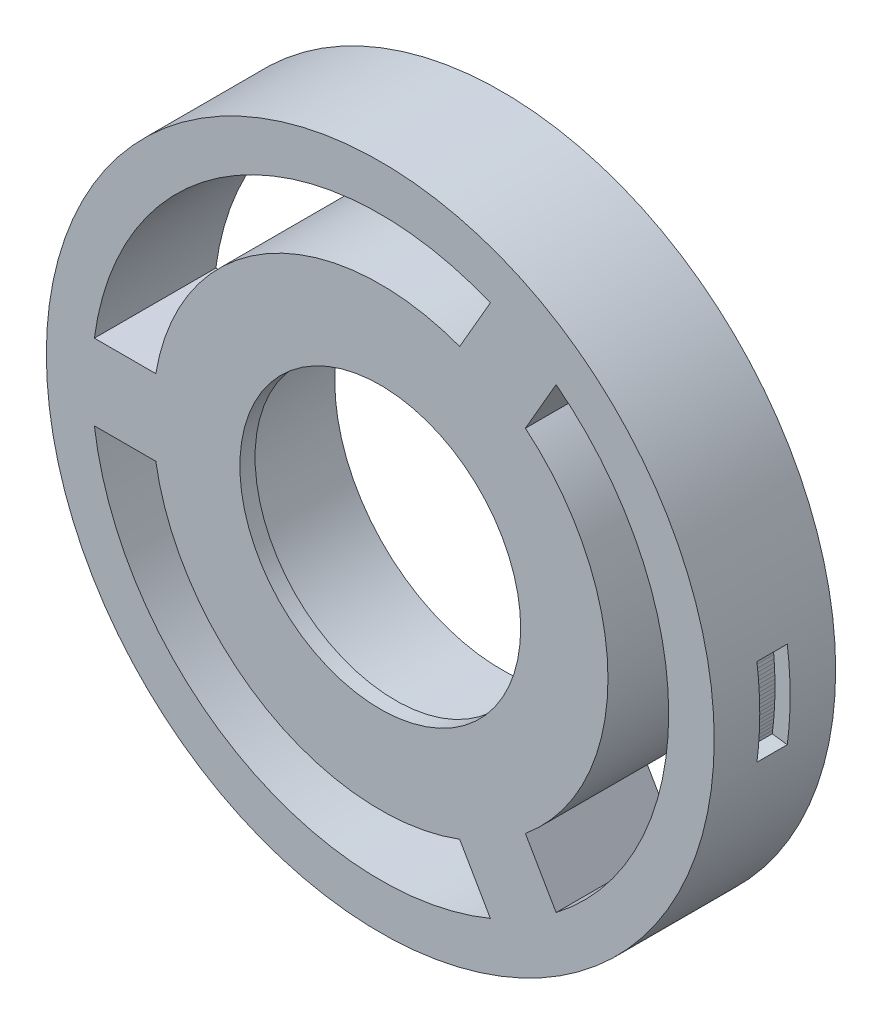
from build123d import *

# Parameters (mm, degrees)
SKETCH1_R          = 22
SKETCH1_R_2        = 19
OUTER_RING_DEPTH   = 8
SKETCH2_R          = 15
SKETCH2_R_2        = 9.25
HUB_DEPTH          = 8
SKETCH3_W          = 6
SKETCH3_H          = 5
SPOKES_DEPTH       = 8
SKETCH4_R          = 11
BEARING_SEAT_DEPTH = 7
SCREW_GROOVE_DEPTH = 2


with BuildPart() as part:
    # Sketch1 → Outer_ring (new body)
    with BuildSketch(Plane.XY):
        Circle(SKETCH1_R)
        Circle(SKETCH1_R_2, mode=Mode.SUBTRACT)
    extrude(amount=OUTER_RING_DEPTH)



with BuildPart() as body_2:
    # Sketch2 → Hub (new body)
    with BuildSketch(Plane.XY):
        Circle(SKETCH2_R)
        Circle(SKETCH2_R_2, mode=Mode.SUBTRACT)
    extrude(amount=HUB_DEPTH)


with BuildPart() as part_1:
    add(part.part)

    add(body_2.part)  # Spokes merges body 2
    # Sketch3 → Spokes (add)
    with BuildSketch(Plane.XY):
        Polygon((9.165063509, 10.874355653), (12.165063509, 16.070508076), (7.834936491, 18.570508076), (4.834936491, 13.374355653), align=None)
        with Locations((-17, 0)):
            Rectangle(SKETCH3_W, SKETCH3_H)
        Polygon((4.834936491, -13.374355653), (7.834936491, -18.570508076), (12.165063509, -16.070508076), (9.165063509, -10.874355653), align=None)
    extrude(amount=SPOKES_DEPTH)

    # Sketch4 → Bearing_seat (cut)
    with BuildSketch(Plane.XY):
        Circle(SKETCH4_R)
    extrude(amount=BEARING_SEAT_DEPTH, mode=Mode.SUBTRACT)

    # Sketch5 → Screw_groove (cut)
    with BuildSketch(Plane.XY.offset(3)):
        Polygon((20.820342089, -2.741050037), (20.849003007, -2.513776761), (20.875183103, -2.286204372), (20.89887926, -2.058359947), (20.92008866, -1.830270598), (20.938808778, -1.601963465), (20.955037388, -1.373465714), (20.968772558, -1.144804534), (20.980012653, -0.916007135), (20.988756337, -0.687100739), (20.995002569, -0.458112586), (20.998750605, -0.229069921), (21, 0), (20.998750605, 0.229069921), (20.995002569, 0.458112586), (20.988756337, 0.687100739), (20.980012653, 0.916007135), (20.968772558, 1.144804534), (20.955037388, 1.373465714), (20.938808778, 1.601963465), (20.92008866, 1.830270598), (20.89887926, 2.058359947), (20.875183103, 2.286204372), (20.849003007, 2.513776761), (20.820342089, 2.741050037), (23.298954242, 3.067365517), (23.298954242, -3.067365517), align=None)
    extrude(amount=SCREW_GROOVE_DEPTH, mode=Mode.SUBTRACT)


solid = part_1.part
